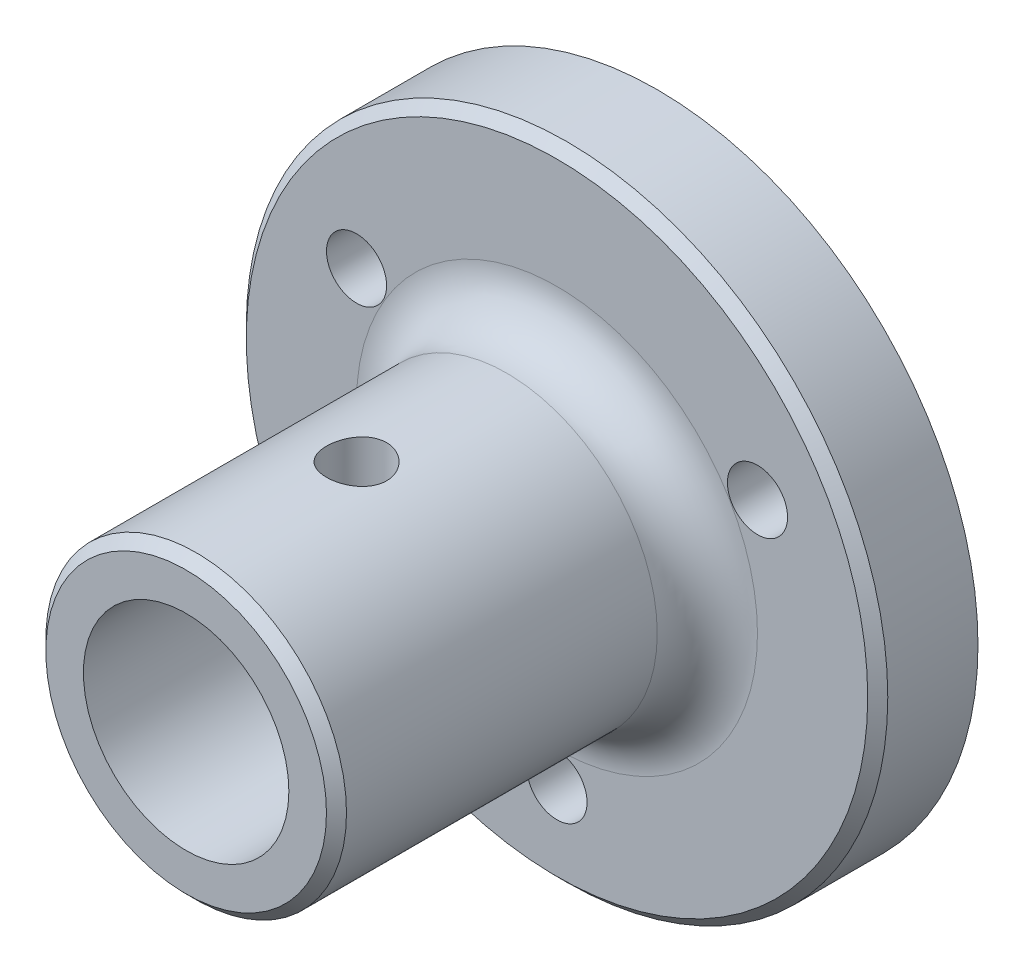
from build123d import *

# Parameters (mm, degrees)
SKETCH1_R               = 32
SKETCH1_R_2             = 3
BOSS_EXTRUDE1_DEPTH     = 10
SKETCH2_R               = 15
SKETCH2_R_2             = 10.25
BOSS_EXTRUDE2_DEPTH     = 37
CUT_EXTRUDE1_DEPTH      = 66.245689513
CUT_EXTRUDE1_DEPTH_BACK = 66.245689513
SKETCH3_R               = 3
FILLET_1_R              = 5
CHAMFER_1_SIZE          = 1


with BuildPart() as part:
    # Sketch1 → Boss-Extrude1 (new body)
    with BuildSketch(Plane.XY):
        Circle(SKETCH1_R)
        with Locations((20, 11.547005384)):
            Circle(SKETCH1_R_2, mode=Mode.SUBTRACT)
        with Locations((0, -23.094010768)):
            Circle(SKETCH1_R_2, mode=Mode.SUBTRACT)
        with Locations((-20, 11.547005384)):
            Circle(SKETCH1_R_2, mode=Mode.SUBTRACT)
    extrude(amount=BOSS_EXTRUDE1_DEPTH)

    # Sketch2 → Boss-Extrude2 (add)
    with BuildSketch(Plane.XY.offset(10)):
        Circle(SKETCH2_R)
        Circle(SKETCH2_R_2, mode=Mode.SUBTRACT)
    extrude(amount=BOSS_EXTRUDE2_DEPTH)

    # Sketch3 → Cut-Extrude1 (cut, two sides: drawn at the far end of the back side and taken through both)
    with BuildSketch(Plane(origin=(0, 0, 0), x_dir=(1, 0, 0), z_dir=(0, 1, 0)).offset(-CUT_EXTRUDE1_DEPTH_BACK)):
        with Locations(Location((0, -30, 0), (0, 0, 270))):
            Circle(SKETCH3_R)
    extrude(amount=CUT_EXTRUDE1_DEPTH + CUT_EXTRUDE1_DEPTH_BACK, mode=Mode.SUBTRACT)

    # 圆角1
    fillet_1_edges = [part.edges().sort_by_distance(p)[0] for p in [
        (-15, 0, 10),
    ]]
    fillet(fillet_1_edges, radius=FILLET_1_R)

    # 倒角1
    chamfer_1_edges = [part.edges().sort_by_distance(p)[0] for p in [
        (-15, 0, 47),
        (-32, 0, 10),
    ]]
    chamfer(chamfer_1_edges, length=CHAMFER_1_SIZE)


solid = part.part
